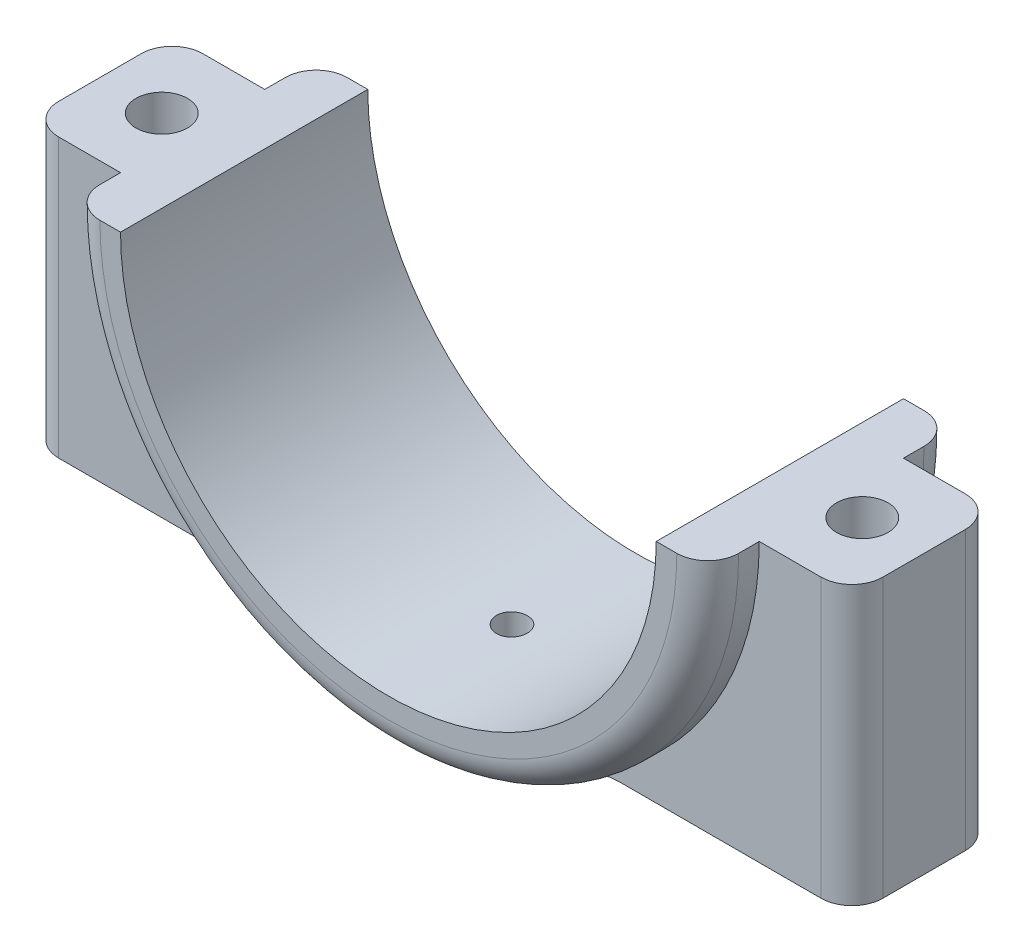
from build123d import *

# Parameters (mm, degrees)
EXTRUDE_1_DEPTH     = 12
CUT_EXTRUDE_START   = -5
CUT_EXTRUDE_1_DEPTH = 5
FILLET_1_R          = 3
SKETCH_3_R          = 2.500000000000002
CUT_EXTRUDE_2_DEPTH = 53.009614555387756
SKETCH_4_R          = 1.5
CUT_EXTRUDE_3_DEPTH = 53.009614555387756
FILLET_2_R          = 10


with BuildPart() as part:
    # 草图1 → 拉伸1 (new body)
    with BuildSketch(Plane.XY):
        with BuildLine():
            Line((26.000000000000004, 0), (40.00000000000001, 0))
            Line((40.00000000000001, 0), (40.000000000000014, -27))
            Line((40.000000000000014, -27), (15.231546211727823, -26.99999999999999))
            ThreePointArc((15.231546211727823, -26.99999999999999), (8.78e-15, -31), (-15.231546211727816, -27))
            Line((-15.231546211727816, -27), (-39.999999999999986, -27))
            Line((-39.999999999999986, -27), (-39.99999999999999, 0))
            Line((-39.99999999999999, 0), (-26.000000000000004, 0))
            ThreePointArc((-26.000000000000004, 0), (-4.78e-15, -26.000000000000004), (26.000000000000004, 0))
        make_face()
    extrude(amount=EXTRUDE_1_DEPTH)

    # 草图2 → 切除-拉伸1 (cut)
    with BuildSketch(Plane.XY.offset(12).offset(CUT_EXTRUDE_START)):
        with BuildLine():
            Line((-39.999999999999986, -27), (-15.231546211727814, -26.999999999999996))
            ThreePointArc((-15.231546211727814, -26.999999999999996), (-26.769179409944208, -15.633650684284165), (-30.999999999999993, 0))
            Line((-30.999999999999993, 0), (-39.99999999999999, 0))
            Line((-39.99999999999999, 0), (-39.999999999999986, -27))
        make_face()
        with BuildLine():
            Line((40.00000000000001, 0), (30.999999999999993, 0))
            ThreePointArc((30.999999999999993, 0), (26.769179409944208, -15.633650684284161), (15.231546211727823, -26.99999999999999))
            Line((15.231546211727823, -26.99999999999999), (40.000000000000014, -27))
            Line((40.000000000000014, -27), (40.00000000000001, 0))
        make_face()
    extrude(amount=CUT_EXTRUDE_1_DEPTH, mode=Mode.SUBTRACT)

    # 镜向1: part across plane


with BuildPart() as part_1:
    add(part.part)
    add(part.part.mirror(Plane.XY))

    # 圆角1
    fillet_1_edges = [part_1.edges().sort_by_distance(p)[0] for p in [
        (3.232e-14, -30.99999999999998, 12),
        (-39.999999999999986, -13.5, 7),
        (40.000000000000014, -13.5, 7),
        (40.000000000000014, -13.5, -7),
        (-39.999999999999986, -13.5, -7),
        (3.232e-14, -30.99999999999998, -12),
    ]]
    fillet(fillet_1_edges, radius=FILLET_1_R)

    # 草图3 → 切除-拉伸2 (cut, through all)
    with BuildSketch(Plane(origin=(0, 0, 0), x_dir=(1, 0, 0), z_dir=(0, 1, 0))):
        with Locations(Location((-33.99999999999999, 0, 0), (0, 0, 270))):
            Circle(SKETCH_3_R)
    cut_extrude_2 = extrude(amount=-CUT_EXTRUDE_2_DEPTH, mode=Mode.SUBTRACT)

    # 镜向2: 切除-拉伸2 across plane
    add(cut_extrude_2.mirror(Plane(origin=(0, 0, 0), x_dir=(0, 0, 1), z_dir=(1, 0, 0))), mode=Mode.SUBTRACT)

    # 草图4 → 切除-拉伸3 (cut, through all)
    with BuildSketch(Plane(origin=(0, 0, 0), x_dir=(1, 0, 0), z_dir=(0, 1, 0))):
        with Locations(Location((0, 0, 0), (0, 0, 270))):
            Circle(SKETCH_4_R)
    extrude(amount=-CUT_EXTRUDE_3_DEPTH, mode=Mode.SUBTRACT)

    # 圆角2
    fillet_2_edges = [part_1.edges().sort_by_distance(p)[0] for p in [
        (-15.231546211727814, -26.999999999999996, 0),
        (15.23154621172782, -26.999999999999986, 0),
    ]]
    fillet(fillet_2_edges, radius=FILLET_2_R)


solid = part_1.part
